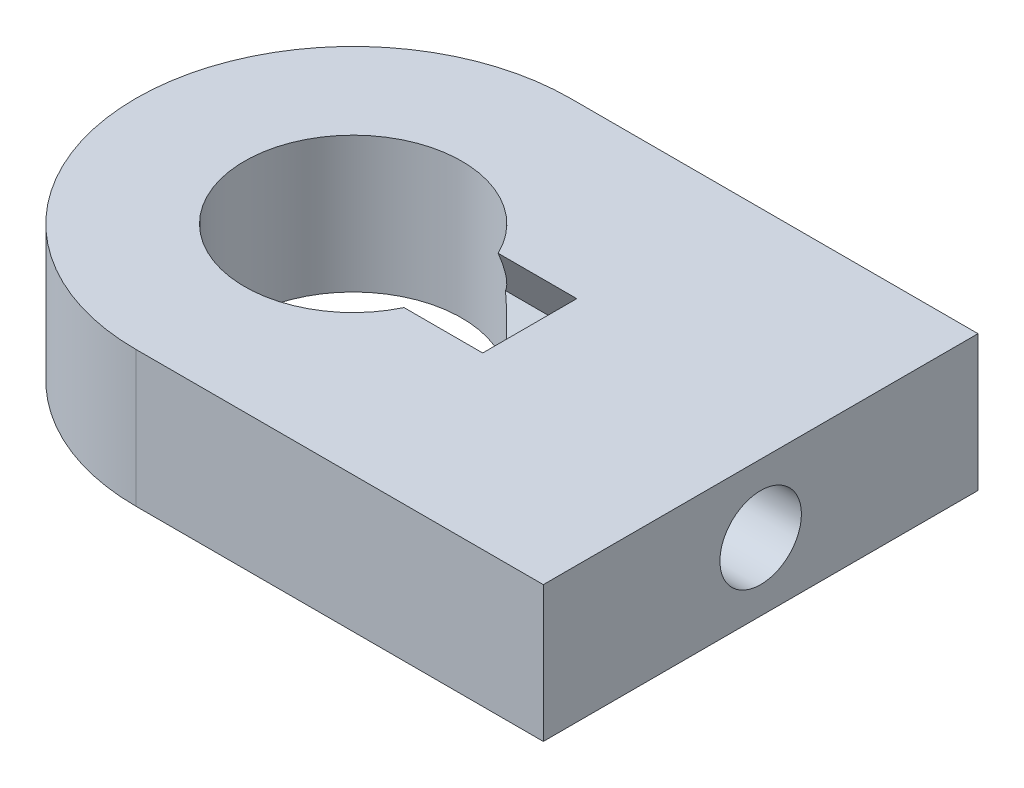
from build123d import *

# Parameters (mm, degrees)
SKETCH1_R           = 4
BOSS_EXTRUDE1_DEPTH = 5
CUT_EXTRUDE1_REACH  = 26.86
SKETCH2_R           = 1.5
CUT_EXTRUDE2_REACH  = 35.36
CUT_EXTRUDE2_START  = -8.5
SKETCH2_4_R         = 1.5


with BuildPart() as part:
    # Sketch1 → Boss-Extrude1 (new body)
    with BuildSketch(Plane(origin=(0, 0, 0), x_dir=(1, 0, 0), z_dir=(0, 1, 0))):
        with BuildLine():
            Line((0, 8), (15, 8))
            Line((15, 8), (15, -8))
            Line((15, -8), (0, -8))
            ThreePointArc((0, -8), (-8, 0), (0, 8))
        make_face()
        Circle(SKETCH1_R, mode=Mode.SUBTRACT)
    extrude(amount=BOSS_EXTRUDE1_DEPTH)

    # Sketch2 → Cut-Extrude1 (cut, up to next)
    with BuildSketch(Plane(origin=(15, 0, 0), x_dir=(0, 0, -1), z_dir=(1, 0, 0)), mode=Mode.PRIVATE) as cut_extrude1_sk1:
        with Locations((0, 2.5)):
            Circle(SKETCH2_R)
    cut_extrude1_tool1 = extrude(cut_extrude1_sk1.sketch, amount=-CUT_EXTRUDE1_REACH, mode=Mode.PRIVATE) & part.part
    add(cut_extrude1_tool1.solids().sort_by_distance((15, 2.5, 0))[0], mode=Mode.SUBTRACT)

    # Sketch2<4> → Cut-Extrude2 (cut, up to next)
    with BuildSketch(Plane(origin=(15, 0, 0), x_dir=(0, 0, -1), z_dir=(1, 0, 0)).offset(CUT_EXTRUDE2_START), mode=Mode.PRIVATE) as cut_extrude2_sk1:
        Polygon((3.175426481, 2.5), (1.58771324, 5.25), (-1.58771324, 5.25), (-3.175426481, 2.5), (-1.58771324, -0.25), (1.58771324, -0.25), align=None)
        with Locations((0, 2.5)):
            Circle(SKETCH2_4_R, mode=Mode.SUBTRACT)
    cut_extrude2_tool1 = extrude(cut_extrude2_sk1.sketch, amount=-CUT_EXTRUDE2_REACH, mode=Mode.PRIVATE) & part.part
    add(cut_extrude2_tool1.solids().sort_by_distance((6.5, 3.832993, -2.308812))[0], mode=Mode.SUBTRACT)


solid = part.part
